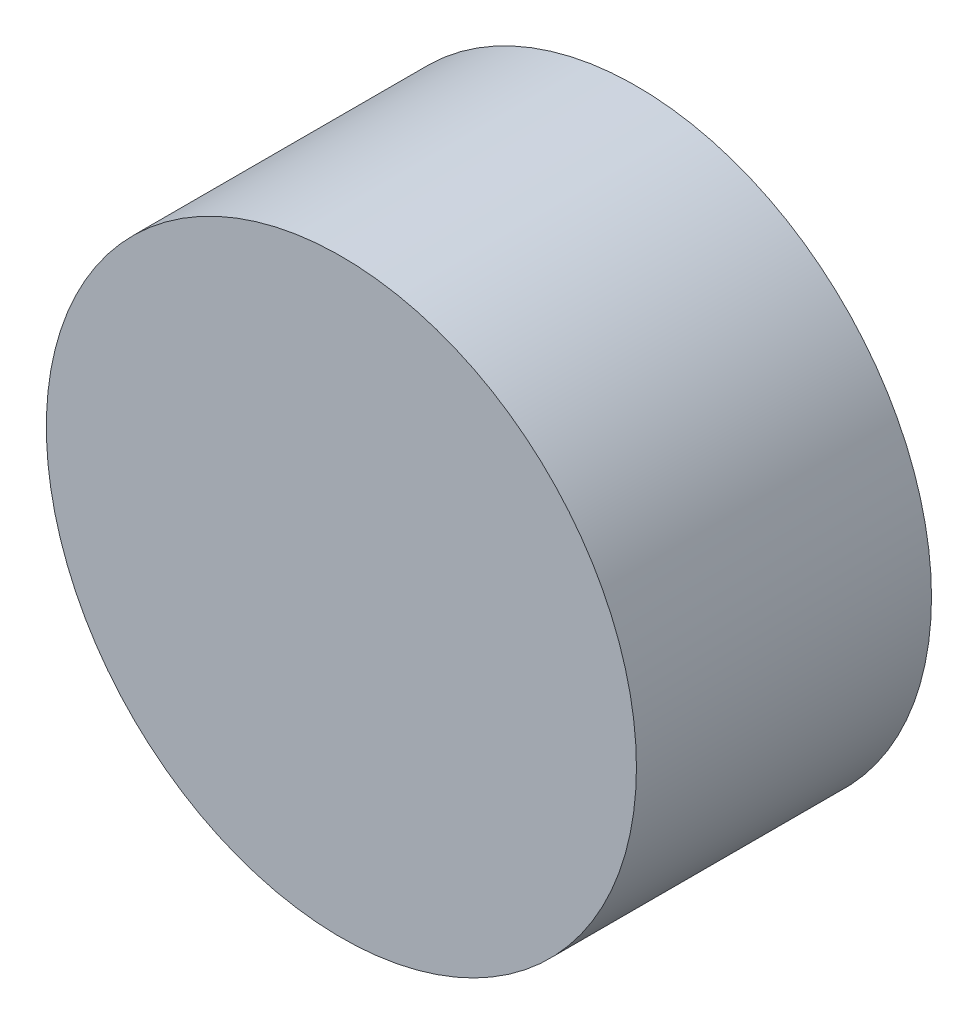
from build123d import *

# Parameters (mm, degrees)
SKETCH1_R           = 25.4
BOSS_EXTRUDE1_DEPTH = 25.4


with BuildPart() as part:
    # Sketch1 → Boss-Extrude1 (new body)
    with BuildSketch(Plane.XY):
        Circle(SKETCH1_R)
    extrude(amount=BOSS_EXTRUDE1_DEPTH)


solid = part.part
